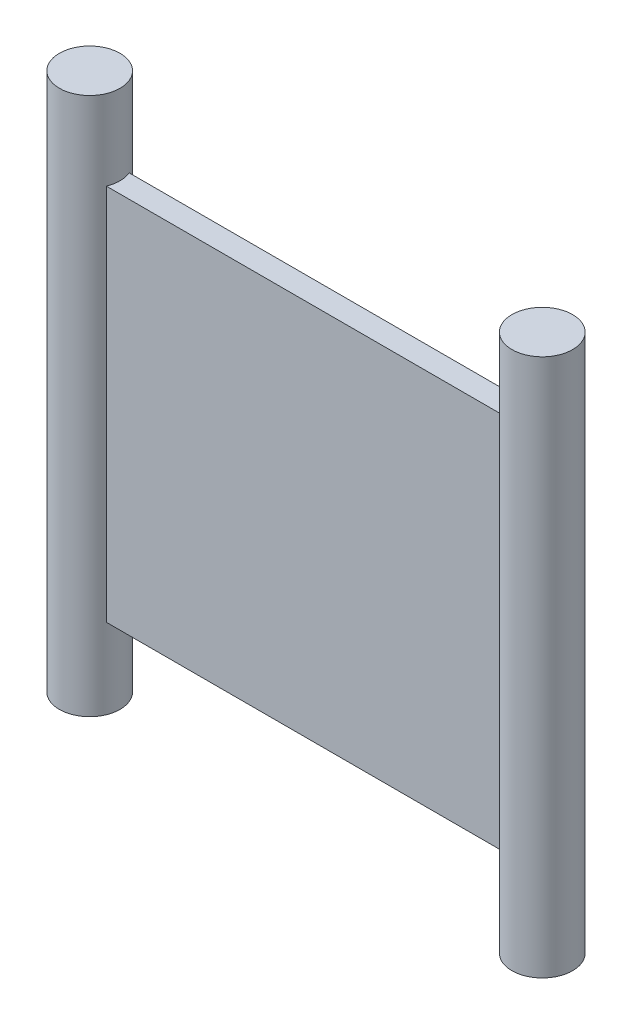
from build123d import *

# Parameters (mm, degrees)
SKETCH1_W           = 19.77
SKETCH1_H           = 1
BOSS_EXTRUDE1_DEPTH = 16.5
SKETCH2_R           = 1.325
BOSS_EXTRUDE2_DEPTH = 11.75


with BuildPart() as part:
    # Sketch1 → Boss-Extrude1 (new body)
    with BuildSketch(Plane(origin=(0, 0, 0), x_dir=(1, 0, 0), z_dir=(0, 1, 0))):
        Rectangle(SKETCH1_W, SKETCH1_H)
    extrude(amount=BOSS_EXTRUDE1_DEPTH)

    # Sketch2 → Boss-Extrude2 (add, symmetric)
    with BuildSketch(Plane(origin=(0, 8.25, 0), x_dir=(1, 0, 0), z_dir=(0, 1, 0))):
        with Locations(Location((-9.885, 0, 0), (0, 0, 270))):
            Circle(SKETCH2_R)
        with Locations(Location((9.885, 0, 0), (0, 0, 270))):
            Circle(SKETCH2_R)
    extrude(amount=BOSS_EXTRUDE2_DEPTH, both=True)


solid = part.part
